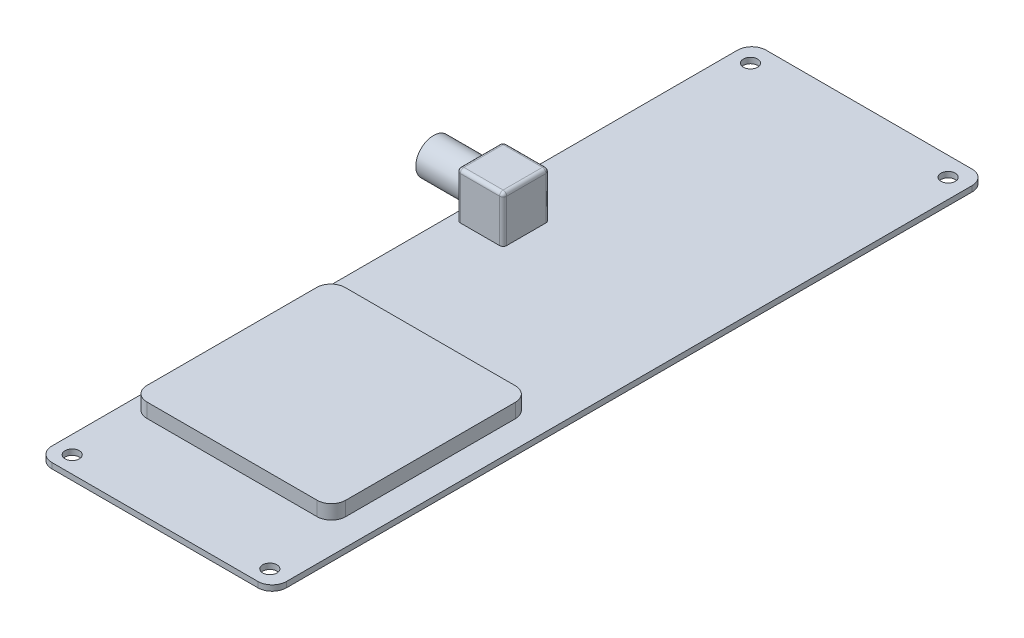
from build123d import *

# Parameters (mm, degrees)
SKETCH1_R           = 1
BOSS_EXTRUDE1_DEPTH = 0.78
SKETCH2_W           = 6.5
SKETCH2_H           = 6.5
BOSS_EXTRUDE2_DEPTH = 6.5
FILLET1_R           = 0.5
SKETCH3_R           = 2.5
BOSS_EXTRUDE3_DEPTH = 6.5
BOSS_EXTRUDE4_DEPTH = 2


with BuildPart() as part:
    # Sketch1 → Boss-Extrude1 (new body)
    with BuildSketch(Plane(origin=(0, 0, 0), x_dir=(1, 0, 0), z_dir=(0, 1, 0))):
        with BuildLine():
            Line((-14.445, -50.065), (14.445, -50.065))
            ThreePointArc((14.445, -50.065), (15.859213562, -49.479213562), (16.445, -48.065))
            Line((16.445, -48.065), (16.445, 48.065))
            ThreePointArc((16.445, 48.065), (15.859213562, 49.479213562), (14.445, 50.065))
            Line((14.445, 50.065), (-14.445, 50.065))
            ThreePointArc((-14.445, 50.065), (-15.859213562, 49.479213562), (-16.445, 48.065))
            Line((-16.445, 48.065), (-16.445, -48.065))
            ThreePointArc((-16.445, -48.065), (-15.859213562, -49.479213562), (-14.445, -50.065))
        make_face()
        with Locations(Location((-13.957298137, 47.395, 0), (0, 0, 90))):
            Circle(SKETCH1_R, mode=Mode.SUBTRACT)
        with Locations(Location((13.752701863, 47.395, 0), (0, 0, 90))):
            Circle(SKETCH1_R, mode=Mode.SUBTRACT)
        with Locations(Location((13.752701863, -47.705, 0), (0, 0, 90))):
            Circle(SKETCH1_R, mode=Mode.SUBTRACT)
        with Locations(Location((-13.957298137, -47.705, 0), (0, 0, 90))):
            Circle(SKETCH1_R, mode=Mode.SUBTRACT)
    extrude(amount=BOSS_EXTRUDE1_DEPTH)

    # Sketch2 → Boss-Extrude2 (add)
    with BuildSketch(Plane(origin=(0, 0.78, 0), x_dir=(1, 0, 0), z_dir=(0, 1, 0))):
        with Locations((-12.145631844, 10.899949454)):
            Rectangle(SKETCH2_W, SKETCH2_H)
    extrude(amount=BOSS_EXTRUDE2_DEPTH)

    # Fillet1
    fillet1_edges = [part.edges().sort_by_distance(p)[0] for p in [
        (-15.395631844, 4.03, -14.149949454),
        (-15.395631844, 4.03, -7.649949454),
        (-8.895631844, 4.03, -7.649949454),
        (-8.895631844, 4.03, -14.149949454),
        (-15.395631844, 7.28, -10.899949454),
        (-12.145631844, 7.28, -7.649949454),
        (-8.895631844, 7.28, -10.899949454),
        (-12.145631844, 7.28, -14.149949454),
    ]]
    fillet(fillet1_edges, radius=FILLET1_R)

    # Sketch3 → Boss-Extrude3 (add)
    with BuildSketch(Plane.ZY.offset(15.395631844)):
        with Locations(Location((-10.899949454, 3.78, 0), (0, 0, 180))):
            Circle(SKETCH3_R)
    extrude(amount=BOSS_EXTRUDE3_DEPTH)

    # Sketch4 → Boss-Extrude4 (add)
    with BuildSketch(Plane(origin=(0, 0.78, 0), x_dir=(1, 0, 0), z_dir=(0, 1, 0))):
        with BuildLine():
            Line((-13.135206183, -10.259829813), (10.737242055, -10.259829813))
            ThreePointArc((10.737242055, -10.259829813), (12.151455617, -10.845616251), (12.737242055, -12.259829813))
            Line((12.737242055, -12.259829813), (12.737242055, -36.056331326))
            ThreePointArc((12.737242055, -36.056331326), (12.151455617, -37.470544888), (10.737242055, -38.056331326))
            Line((10.737242055, -38.056331326), (-13.135206183, -38.056331326))
            ThreePointArc((-13.135206183, -38.056331326), (-14.549419745, -37.470544888), (-15.135206183, -36.056331326))
            Line((-15.135206183, -36.056331326), (-15.135206183, -12.259829813))
            ThreePointArc((-15.135206183, -12.259829813), (-14.549419745, -10.845616251), (-13.135206183, -10.259829813))
        make_face()
    extrude(amount=BOSS_EXTRUDE4_DEPTH)


solid = part.part
